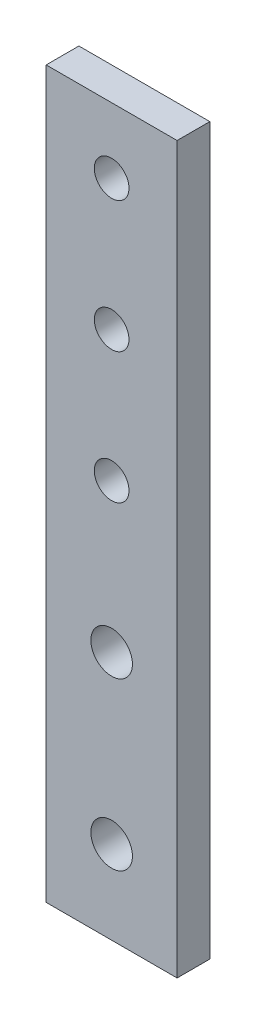
from build123d import *

# Parameters (mm, degrees)
SKETCH1_W                   = 20
SKETCH1_H                   = 110.8
BOSS_EXTRUDE1_DEPTH         = 5
M5_CLEARANCE_HOLE1_D        = 5.3
F_1_4_0_25_DIAMETER_HOLE1_D = 6.35


with BuildPart() as part:
    # Sketch1 → Boss-Extrude1 (new body)
    with BuildSketch(Plane.XY):
        with Locations((6.519823789, 20.433039648)):
            Rectangle(SKETCH1_W, SKETCH1_H)
    extrude(amount=BOSS_EXTRUDE1_DEPTH)

    # M5 Clearance Hole1 (through all)
    with Locations(Plane.XY.offset(5)):
        with Locations((6.519823789, 65.833039648), (6.519823789, 45.833039648), (6.519823789, 25.833039648)):
            Hole(M5_CLEARANCE_HOLE1_D / 2)

    # 1/4 (0.25) Diameter Hole1 (through all)
    with Locations(Plane.XY.offset(5)):
        with Locations((6.519823789, 3.133039648), (6.519823789, -22.266960352)):
            Hole(F_1_4_0_25_DIAMETER_HOLE1_D / 2)


solid = part.part
